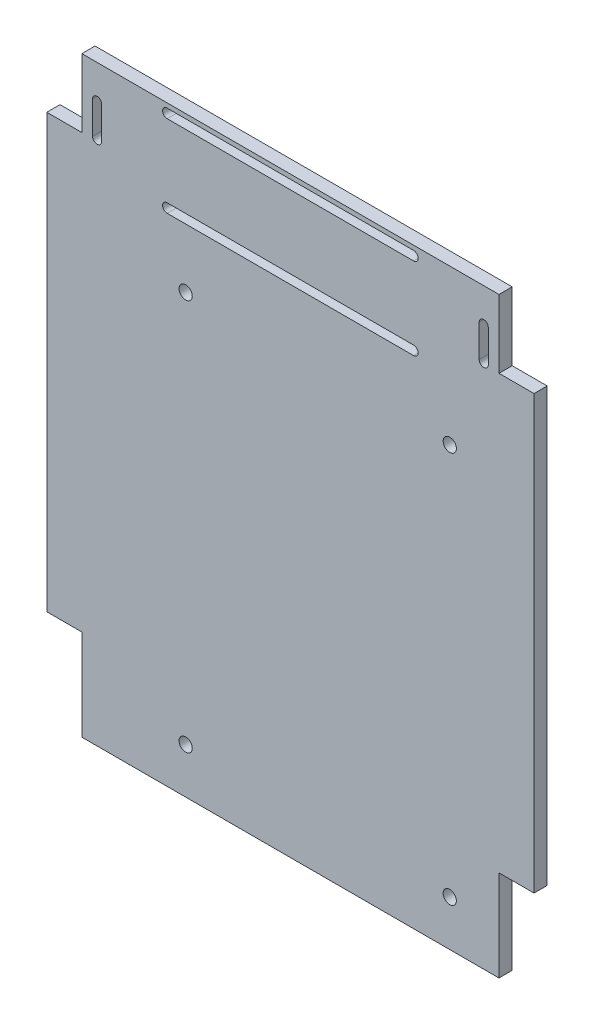
from build123d import *

# Parameters (mm, degrees)
SKETCH1_R           = 1.45
BOSS_EXTRUDE2_DEPTH = 2.9


with BuildPart() as part:
    # Sketch1 → Boss-Extrude2 (new body)
    with BuildSketch(Plane.XY):
        Polygon((-53.5, -47.5), (-45.8, -47.5), (-45.8, -67.5), (45.8, -67.5), (45.8, -47.5), (53.5, -47.5), (53.5, 47.5), (45.803905178, 47.5), (45.803905178, 62.5), (-45.8, 62.5), (-45.8, 47.5), (-53.5, 47.5), align=None)
        with Locations((35, -57.5)):
            Circle(SKETCH1_R, mode=Mode.SUBTRACT)
        with Locations((35, 28.5)):
            Circle(SKETCH1_R, mode=Mode.SUBTRACT)
        with Locations((-23, -57.5)):
            Circle(SKETCH1_R, mode=Mode.SUBTRACT)
        with Locations((-23, 28.5)):
            Circle(SKETCH1_R, mode=Mode.SUBTRACT)
        with BuildLine():
            Line((-27.063854383, 61.5), (27.063854383, 61.5))
            ThreePointArc((27.063854383, 61.5), (28.063854383, 60.5), (27.063854383, 59.5))
            Line((27.063854383, 59.5), (-27.063854383, 59.5))
            ThreePointArc((-27.063854383, 59.5), (-28.063854383, 60.5), (-27.063854383, 61.5))
        make_face(mode=Mode.SUBTRACT)
        with BuildLine():
            Line((-27.063854383, 41.5), (27.063854383, 41.5))
            ThreePointArc((27.063854383, 41.5), (28.063854383, 42.5), (27.063854383, 43.5))
            Line((27.063854383, 43.5), (-27.063854383, 43.5))
            ThreePointArc((-27.063854383, 43.5), (-28.063854383, 42.5), (-27.063854383, 41.5))
        make_face(mode=Mode.SUBTRACT)
        with BuildLine():
            Line((-41.456619421, 55.059017376), (-41.456619421, 47.940982624))
            ThreePointArc((-41.456619421, 47.940982624), (-42.456619421, 46.940982624), (-43.456619421, 47.940982624))
            Line((-43.456619421, 47.940982624), (-43.456619421, 55.059017376))
            ThreePointArc((-43.456619421, 55.059017376), (-42.456619421, 56.059017376), (-41.456619421, 55.059017376))
        make_face(mode=Mode.SUBTRACT)
        with BuildLine():
            Line((41.456619421, 55.059017376), (41.456619421, 47.940982624))
            ThreePointArc((41.456619421, 47.940982624), (42.456619421, 46.940982624), (43.456619421, 47.940982624))
            Line((43.456619421, 47.940982624), (43.456619421, 55.059017376))
            ThreePointArc((43.456619421, 55.059017376), (42.456619421, 56.059017376), (41.456619421, 55.059017376))
        make_face(mode=Mode.SUBTRACT)
    extrude(amount=BOSS_EXTRUDE2_DEPTH)


solid = part.part
